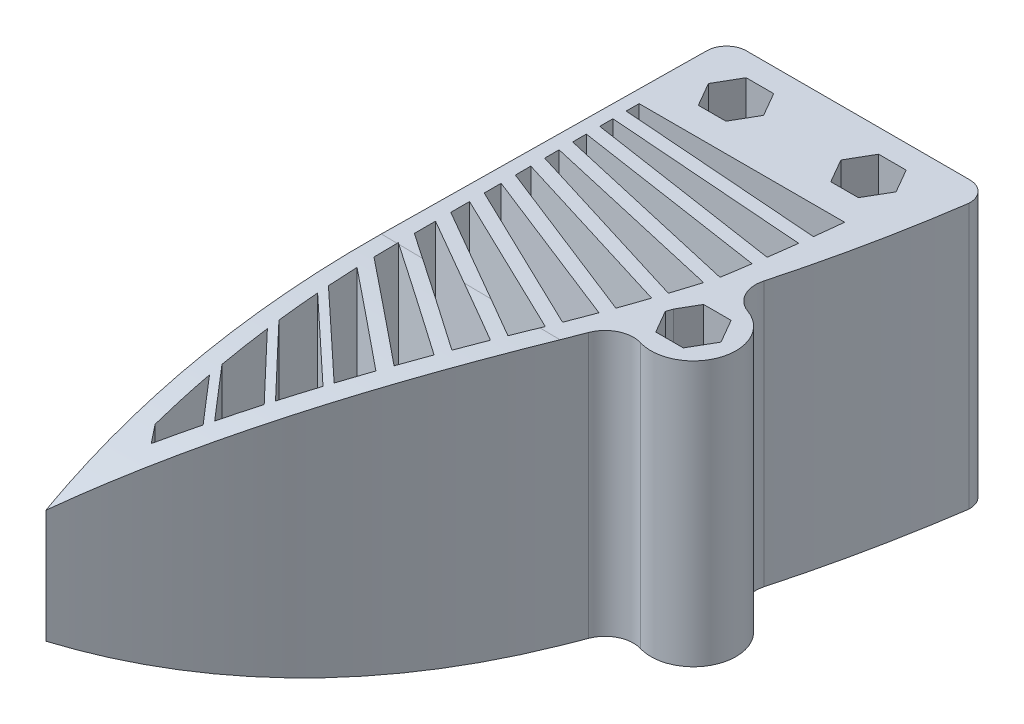
from build123d import *

# Parameters (mm, degrees)
SKETCH_3_R           = 2
EXTRUDE_2_DEPTH      = 40
SCALE_2_SCALE        = 0.7
EXTRUDE_START        = -28
EXTRUDE_3_DEPTH      = 28
SKETCH_6_R           = 1.5
CUT_EXTRUDE_4_DEPTH  = 30
SKETCH_9_R           = 1.5
EXTRUDE_5_DEPTH      = 28
EXTRUDE_6_DEPTH      = 28
SKETCH_12_R          = 1.5
CUT_EXTRUDE_6_DEPTH  = 37
CUT_EXTRUDE_8_DEPTH  = 30
CUT_EXTRUDE_10_DEPTH = 35
EXTRUDE_7_DEPTH      = 28
SKETCH_23_R          = 1
EXTRUDE_8_DEPTH      = 28
CUT_EXTRUDE_7_DEPTH  = 37
SKETCH_24_R          = 4.5
EXTRUDE_9_DEPTH      = 28
FILLET_1_R           = 3


with BuildPart() as part:
    # 草图3 → 凸台-拉伸2 (new body)
    with BuildSketch(Plane(origin=(0, 0, 0), x_dir=(1, 0, 0), z_dir=(0, 1, 0))):
        with BuildLine():
            Line((0, 120.364670388), (0, 1))
            ThreePointArc((0, 1), (0.722246327, 0.039347671), (1.845705794, 0.466350574))
            ThreePointArc((1.845705794, 0.466350574), (20.84747072, 37.000481257), (33.527350269, 76.179945644))
            ThreePointArc((33.527350269, 76.179945644), (34.378342968, 77.668130682), (35.905349356, 78.447319216))
            ThreePointArc((35.905349356, 78.447319216), (39.900282258, 82.371073997), (37.749214417, 87.541010902))
            ThreePointArc((37.749214417, 87.541010902), (36.64631247, 88.853447787), (36.44219633, 90.555569958))
            ThreePointArc((36.44219633, 90.555569958), (38.528750421, 105.336074708), (39.720316086, 120.215496736))
            ThreePointArc((39.720316086, 120.215496736), (38.897448554, 122.432577427), (36.724027178, 123.364670388))
            Line((36.724027178, 123.364670388), (3, 123.364670388))
            ThreePointArc((3, 123.364670388), (0.878679656, 122.485990731), (0, 120.364670388))
        make_face()
        with Locations(Location((35, 83.364670388, 0), (0, 0, 270))):
            Circle(SKETCH_3_R, mode=Mode.SUBTRACT)
        with Locations(Location((35, 118.364670388, 0), (0, 0, 270))):
            Circle(SKETCH_3_R, mode=Mode.SUBTRACT)
        with Locations(Location((5, 118.364670388, 0), (0, 0, 270))):
            Circle(SKETCH_3_R, mode=Mode.SUBTRACT)
        with BuildLine():
            Line((6.404592978, 13.516926157), (1.8, 20.887532698))
            Line((1.8, 20.887532698), (1.8, 4.166952556))
            ThreePointArc((1.8, 4.166952556), (4.143731804, 8.821533656), (6.404592978, 13.516926157))
        make_face(mode=Mode.SUBTRACT)
        with BuildLine():
            Line((10.108701369, 21.710284842), (1.8, 33.238427229))
            Line((1.8, 33.238427229), (1.8, 23.152408171))
            Line((1.8, 23.152408171), (7.010340095, 14.812177672))
            ThreePointArc((7.010340095, 14.812177672), (8.581699979, 18.251269202), (10.108701369, 21.710284842))
        make_face(mode=Mode.SUBTRACT)
        with BuildLine():
            Line((13.360943276, 29.512867752), (1.8, 43.503052476))
            Line((1.8, 43.503052476), (1.8, 35.290776631))
            Line((1.8, 35.290776631), (10.66221999, 22.994639198))
            ThreePointArc((10.66221999, 22.994639198), (12.031133738, 26.245658374), (13.360943276, 29.512867752))
        make_face(mode=Mode.SUBTRACT)
        with BuildLine():
            Line((16.223970717, 36.961262948), (1.8, 52.237399724))
            Line((1.8, 52.237399724), (1.8, 45.386862205))
            Line((1.8, 45.386862205), (13.866413905, 30.784994912))
            ThreePointArc((13.866413905, 30.784994912), (15.062552919, 33.866502174), (16.223970717, 36.961262948))
        make_face(mode=Mode.SUBTRACT)
        with BuildLine():
            Line((18.75085734, 44.092608971), (1.8, 59.820076913))
            Line((1.8, 59.820076913), (1.8, 53.985305955))
            Line((1.8, 53.985305955), (16.685267787, 38.220618747))
            ThreePointArc((16.685267787, 38.220618747), (17.733603559, 41.151147004), (18.75085734, 44.092608971))
        make_face(mode=Mode.SUBTRACT)
        with BuildLine():
            Line((20.868191148, 50.566760797), (1.8, 65.772358036))
            Line((1.8, 65.772358036), (1.8, 61.457038549))
            Line((1.8, 61.457038549), (19.171511459, 45.339276238))
            ThreePointArc((19.171511459, 45.339276238), (20.032066674, 47.949053786), (20.868191148, 50.566760797))
        make_face(mode=Mode.SUBTRACT)
        with BuildLine():
            Line((22.974243013, 57.571710343), (1.8, 72.007377378))
            Line((1.8, 72.007377378), (1.8, 68.330403189))
            Line((1.8, 68.330403189), (21.504437212, 52.617442597))
            ThreePointArc((21.504437212, 52.617442597), (22.250225593, 55.091347023), (22.974243013, 57.571710343))
        make_face(mode=Mode.SUBTRACT)
        with BuildLine():
            Line((24.827629624, 64.328957972), (1.8, 77.623370722))
            Line((1.8, 77.623370722), (1.8, 74.427948576))
            Line((1.8, 74.427948576), (23.548915198, 59.600495336))
            ThreePointArc((23.548915198, 59.600495336), (24.198120154, 61.962063537), (24.827629624, 64.328957972))
        make_face(mode=Mode.SUBTRACT)
        with BuildLine():
            Line((26.461878816, 70.885143812), (1.8, 82.761173702))
            Line((1.8, 82.761173702), (1.8, 79.932745943))
            Line((1.8, 79.932745943), (25.345753049, 66.339207891))
            ThreePointArc((25.345753049, 66.339207891), (25.912863392, 68.609954504), (26.461878816, 70.885143812))
        make_face(mode=Mode.SUBTRACT)
        with BuildLine():
            Line((27.903926427, 77.284451229), (1.8, 87.529070114))
            Line((1.8, 87.529070114), (1.8, 84.980988462))
            Line((1.8, 84.980988462), (26.927669734, 72.880655026))
            ThreePointArc((26.927669734, 72.880655026), (27.424243887, 75.080680817), (27.903926427, 77.284451229))
        make_face(mode=Mode.SUBTRACT)
        with BuildLine():
            Line((29.175137635, 83.569053675), (1.8, 92.012833113))
            Line((1.8, 92.012833113), (1.8, 89.677577503))
            Line((1.8, 89.677577503), (28.320844309, 79.269337072))
            ThreePointArc((28.320844309, 79.269337072), (28.756005088, 81.417603081), (29.175137635, 83.569053675))
        make_face(mode=Mode.SUBTRACT)
        with BuildLine():
            Line((30.292091958, 89.779646522), (1.8, 96.282531447))
            Line((1.8, 96.282531447), (1.8, 94.105811431))
            Line((1.8, 94.105811431), (29.545931615, 85.547661697))
            ThreePointArc((29.545931615, 85.547661697), (29.926744008, 87.662290807), (30.292091958, 89.779646522))
        make_face(mode=Mode.SUBTRACT)
        with BuildLine():
            Line((31.267160482, 95.956031632), (1.8, 100.397324466))
            Line((1.8, 100.397324466), (1.8, 98.333961282))
            Line((1.8, 98.333961282), (30.618838123, 91.756501534))
            ThreePointArc((30.618838123, 91.756501534), (30.950586551, 93.855095266), (31.267160482, 95.956031632))
        make_face(mode=Mode.SUBTRACT)
        with BuildLine():
            Line((32.108897466, 102.137737837), (1.8, 104.408991264))
            Line((1.8, 104.408991264), (1.8, 102.419913444))
            Line((1.8, 102.419913444), (31.551287828, 97.935796913))
            ThreePointArc((31.551287828, 97.935796913), (31.837665489, 100.035762437), (32.108897466, 102.137737837))
        make_face(mode=Mode.SUBTRACT)
        with BuildLine():
            Line((32.822260718, 108.364670388), (1.8, 108.364670388))
            Line((1.8, 108.364670388), (1.8, 106.414598935))
            Line((1.8, 106.414598935), (32.351201095, 104.125188036))
            ThreePointArc((32.351201095, 104.125188036), (32.594419706, 106.24407489), (32.822260718, 108.364670388))
        make_face(mode=Mode.SUBTRACT)
        with BuildLine():
            Line((1.8, 110.364670388), (33.02290127, 110.364670388))
            ThreePointArc((33.02290127, 110.364670388), (33.164293245, 111.864318022), (33.298, 113.364670388))
            Line((33.298, 113.364670388), (1.8, 113.364670388))
            Line((1.8, 113.364670388), (1.8, 110.364670388))
        make_face(mode=Mode.SUBTRACT)
    extrude(amount=EXTRUDE_2_DEPTH)


with BuildPart() as part_1:
    # 缩放比例2: scaled about (17.639096178, 20, -80.17321458)
    add(part.part.scale(SCALE_2_SCALE).moved(Location((5.291728853, 6, -24.051964374))))

    # 草图7 → 凸台-拉伸3 (add)
    with BuildSketch(Plane(origin=(0, 34, 0), x_dir=(1, 0, 0), z_dir=(0, 1, 0)).offset(EXTRUDE_START)):
        with BuildLine():
            Line((3.291728853, 19.356429269), (3.291728853, 29.356429269))
            Line((3.291728853, 29.356429269), (4.291728853, 29.356429269))
            Line((4.291728853, 29.356429269), (5.291728853, 108.307233646))
            Line((5.291728853, 108.307233646), (5.291728853, 24.751964374))
            ThreePointArc((5.291728853, 24.751964374), (5.797301282, 24.079507744), (6.583722909, 24.378409776))
            ThreePointArc((6.583722909, 24.378409776), (4.959489095, 21.853153364), (3.291728853, 19.356429269))
        make_face()
    extrude(amount=EXTRUDE_3_DEPTH)

    # 草图6 → 切除-拉伸4 (cut)
    with BuildSketch(Plane(origin=(0, 34, 0), x_dir=(1, 0, 0), z_dir=(0, 1, 0))):
        with Locations(Location((8.791728853, 106.907233646, 0), (0, 0, 270))):
            Circle(SKETCH_6_R)
        with Locations(Location((29.791728853, 106.907233646, 0), (0, 0, 270))):
            Circle(SKETCH_6_R)
        with Locations(Location((29.791728853, 82.407233646, 0), (0, 0, 270))):
            Circle(SKETCH_6_R)
    extrude(amount=-CUT_EXTRUDE_4_DEPTH, mode=Mode.SUBTRACT)

    # 草图9 → 凸台-拉伸5 (add)
    with BuildSketch(Plane(origin=(0, 34, 0), x_dir=(1, 0, 0), z_dir=(0, 1, 0))):
        with Locations((29.791728853, 106.907233646)):
            Circle(SKETCH_9_R)
        with Locations((8.791728853, 106.907233646)):
            Circle(SKETCH_9_R)
    extrude(amount=-EXTRUDE_5_DEPTH)

    # 草图17 → 凸台-拉伸6 (add)
    with BuildSketch(Plane(origin=(0, 34, 0), x_dir=(1, 0, 0), z_dir=(0, 1, 0)).offset(EXTRUDE_START)):
        with BuildLine():
            Line((28.600328853, 103.407233646), (6.551728853, 103.407233646))
            Line((6.551728853, 103.407233646), (6.551728853, 101.307233646))
            Line((6.551728853, 101.307233646), (28.407759742, 101.307233646))
            ThreePointArc((28.407759742, 101.307233646), (28.506734125, 102.35698699), (28.600328853, 103.407233646))
        make_face()
    extrude(amount=EXTRUDE_6_DEPTH)

    # 草图12 → 切除-拉伸6 (cut)
    with BuildSketch(Plane(origin=(0, 34, 0), x_dir=(1, 0, 0), z_dir=(0, 1, 0))):
        with Locations(Location((11.291728853, 105.407233646, 0), (0, 0, 270))):
            Circle(SKETCH_12_R)
        with Locations(Location((25.291728853, 105.407233646, 0), (0, 0, 270))):
            Circle(SKETCH_12_R)
    extrude(amount=-CUT_EXTRUDE_6_DEPTH, mode=Mode.SUBTRACT)

    # 草图18 → 切除-拉伸8 (cut)
    with BuildSketch(Plane(origin=(0, 34, 0), x_dir=(1, 0, 0), z_dir=(0, 1, 0))):
        Polygon((12.749538283, 102.882233646), (14.207347713, 105.407233646), (12.749538283, 107.932233646), (9.833919424, 107.932233646), (8.376109994, 105.407233646), (9.833919424, 102.882233646), align=None)
        Polygon((26.749538283, 102.882233646), (28.207347713, 105.407233646), (26.749538283, 107.932233646), (23.833919424, 107.932233646), (22.376109994, 105.407233646), (23.833919424, 102.882233646), align=None)
    extrude(amount=-CUT_EXTRUDE_8_DEPTH, mode=Mode.SUBTRACT)

    # 草图21 → 切除-拉伸10 (cut)
    with BuildSketch(Plane(origin=(0, 34, 0), x_dir=(1, 0, 0), z_dir=(0, 1, 0))):
        with BuildLine():
            Line((0.532074675, 19.356429269), (4.418390007, 19.356429269))
            Line((4.418390007, 19.356429269), (45.436728425, 19.356429269))
            Line((45.436728425, 19.356429269), (45.436728425, 108.202812089))
            Line((45.436728425, 108.202812089), (33.095950113, 108.202812089))
            ThreePointArc((33.095950113, 108.202812089), (23.104228056, 71.96887897), (4.418390007, 39.356429269))
            Line((4.418390007, 39.356429269), (0.532074675, 19.356429269))
        make_face()
    extrude(amount=-CUT_EXTRUDE_10_DEPTH, mode=Mode.SUBTRACT)

    # 草图22 → 凸台-拉伸7 (add)
    with BuildSketch(Plane(origin=(0, 34, 0), x_dir=(1, 0, 0), z_dir=(0, 1, 0))):
        with BuildLine():
            Line((4.418390007, 39.356429269), (4.461744482, 42.779299896))
            ThreePointArc((4.461744482, 42.779299896), (21.782602995, 74.014075747), (31.116493031, 108.48873106))
            Line((31.116493031, 108.48873106), (33.095950113, 108.202812089))
            ThreePointArc((33.095950113, 108.202812089), (23.104228056, 71.96887897), (4.418390007, 39.356429269))
        make_face()
    extrude(amount=-EXTRUDE_7_DEPTH)

    # 草图23 → 凸台-拉伸8 (add)
    with BuildSketch(Plane(origin=(0, 34, 0), x_dir=(1, 0, 0), z_dir=(0, 1, 0))):
        with Locations((6.551728853, 46.52830549)):
            Circle(SKETCH_23_R)
    extrude(amount=-EXTRUDE_8_DEPTH)

    # 草图13 → 切除-拉伸7 (cut)
    with BuildSketch(Plane(origin=(3.91984655, 0, 0.003977746), x_dir=(-0.012665099517479995, 0, 0.9999197944106379), z_dir=(-0.999919794410638, 0, -0.012665099517479995))):
        with BuildLine():
            Line((-39.363564193, 34), (-74.363564193, 34))
            add(Edge.make_bspline(
                [(-74.363564193, 34), (-53.258272285, 34), (-39.363564193, 26)],
                knots=[0.08514386, 0.08514386, 0.08514386, 1, 1, 1], degree=2))
            Line((-39.363564193, 26), (-39.363564193, 34))
        make_face()
        with BuildLine():
            Line((-74.363564193, 6), (-39.363564193, 6))
            Line((-39.363564193, 6), (-39.363564193, 14))
            add(Edge.make_bspline(
                [(-74.363564193, 6), (-53.258272285, 6), (-39.363564193, 14)],
                knots=[0.08514386, 0.08514386, 0.08514386, 1, 1, 1], degree=2))
        make_face()
    extrude(amount=-CUT_EXTRUDE_7_DEPTH, mode=Mode.SUBTRACT)

    # 草图24 → 凸台-拉伸9 (add)
    with BuildSketch(Plane(origin=(0, 34, 0), x_dir=(1, 0, 0), z_dir=(0, 1, 0))):
        with Locations((29.791728853, 82.407233646)):
            Circle(SKETCH_24_R)
        Polygon((31.249538283, 84.932233646), (28.333919424, 84.932233646), (26.876109994, 82.407233646), (28.333919424, 79.882233646), (31.249538283, 79.882233646), (32.707347713, 82.407233646), align=None, mode=Mode.SUBTRACT)
    extrude(amount=-EXTRUDE_9_DEPTH)

    # 圆角1
    fillet_1_edges = [part_1.edges().sort_by_distance(p)[0] for p in [
        (28.347991548, 20, -86.669348449),
        (26.116060135, 20, -79.811186752),
    ]]
    fillet(fillet_1_edges, radius=FILLET_1_R)


solid = part_1.part
